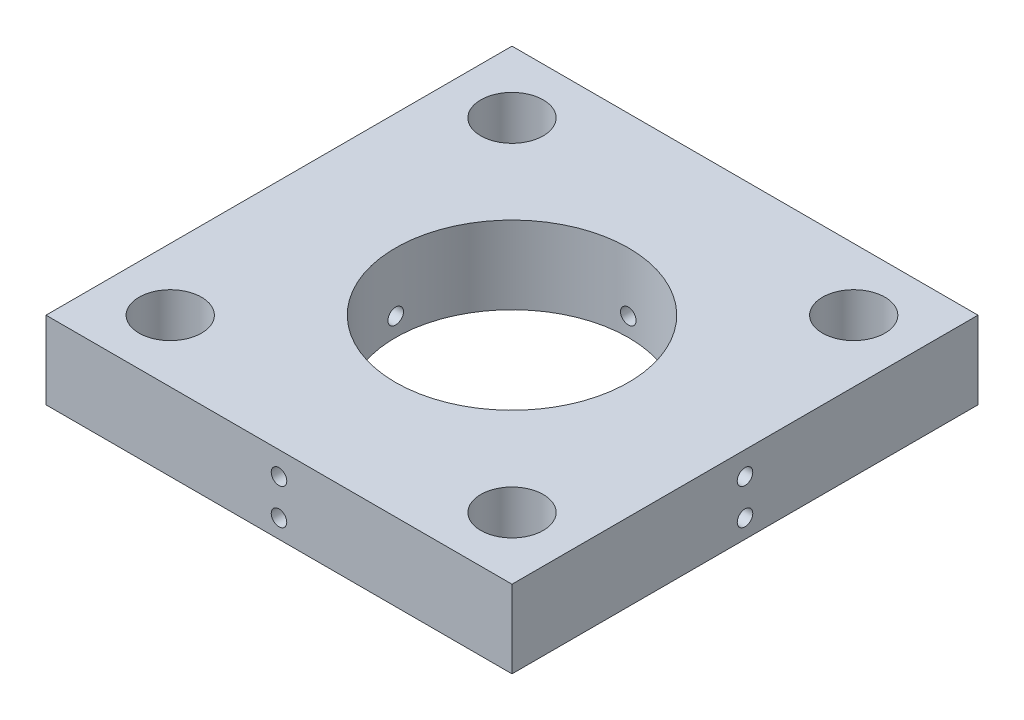
from build123d import *

# Parameters (mm, degrees)
SKETCH1_W                   = 38.1
SKETCH1_H                   = 38.1
BOSS_EXTRUDE1_DEPTH         = 6.35
SKETCH2_R                   = 9.525
CUT_EXTRUDE1_DEPTH          = 28.679008291
SKETCH3_R                   = 0.635
CUT_EXTRUDE2_DEPTH          = 44.067795393
CIRPATTERN1_COUNT           = 4
SKETCH4_R                   = 0.635
CUT_EXTRUDE3_DEPTH          = 5.08
CIRPATTERN2_COUNT           = 4
TAP_DRILL_FOR_1_4_20_TAP1_D = 5.1054


with BuildPart() as part:
    # Sketch1 → Boss-Extrude1 (new body)
    with BuildSketch(Plane(origin=(0, 0, 0), x_dir=(1, 0, 0), z_dir=(0, 1, 0))):
        Rectangle(SKETCH1_W, SKETCH1_H)
    extrude(amount=BOSS_EXTRUDE1_DEPTH)

    # Sketch2 → Cut-Extrude1 (cut, through all)
    with BuildSketch(Plane.XZ):
        with Locations(Location((0, 0, 0), (0, 0, 270))):
            Circle(SKETCH2_R)
    extrude(amount=-CUT_EXTRUDE1_DEPTH, mode=Mode.SUBTRACT)

    # Sketch3 → Cut-Extrude2 (cut, through all)
    with BuildSketch(Plane.XY.offset(19.05)):
        with Locations((0, 1.524)):
            Circle(SKETCH3_R)
    cut_extrude2 = extrude(amount=-CUT_EXTRUDE2_DEPTH, mode=Mode.SUBTRACT)

    # CirPattern1: Cut-Extrude2 ×4 about axis
    cirpattern1_axis = Axis((0, 6.35, 0), (0, -1, 0))
    for i in range(1, CIRPATTERN1_COUNT):
        add(cut_extrude2.rotate(cirpattern1_axis, i * 360 / CIRPATTERN1_COUNT), mode=Mode.SUBTRACT)

    # Sketch4 → Cut-Extrude3 (cut)
    with BuildSketch(Plane.XY.offset(19.05)):
        with Locations((0, 4.445)):
            Circle(SKETCH4_R)
    cut_extrude3 = extrude(amount=-CUT_EXTRUDE3_DEPTH, mode=Mode.SUBTRACT)

    # CirPattern2: Cut-Extrude3 ×4 about axis
    cirpattern2_axis = Axis((0, 0, 0), (0, 1, 0))
    for i in range(1, CIRPATTERN2_COUNT):
        add(cut_extrude3.rotate(cirpattern2_axis, i * 360 / CIRPATTERN2_COUNT), mode=Mode.SUBTRACT)

    # Tap Drill for 1/4-20 Tap1 (through all)
    with Locations(Plane(origin=(0, 6.35, 0), x_dir=(1, 0, 0), z_dir=(0, 1, 0))):
        with Locations((-13.97, 13.97), (13.97, 13.97), (-13.97, -13.97), (13.97, -13.97)):
            Hole(TAP_DRILL_FOR_1_4_20_TAP1_D / 2)


solid = part.part
